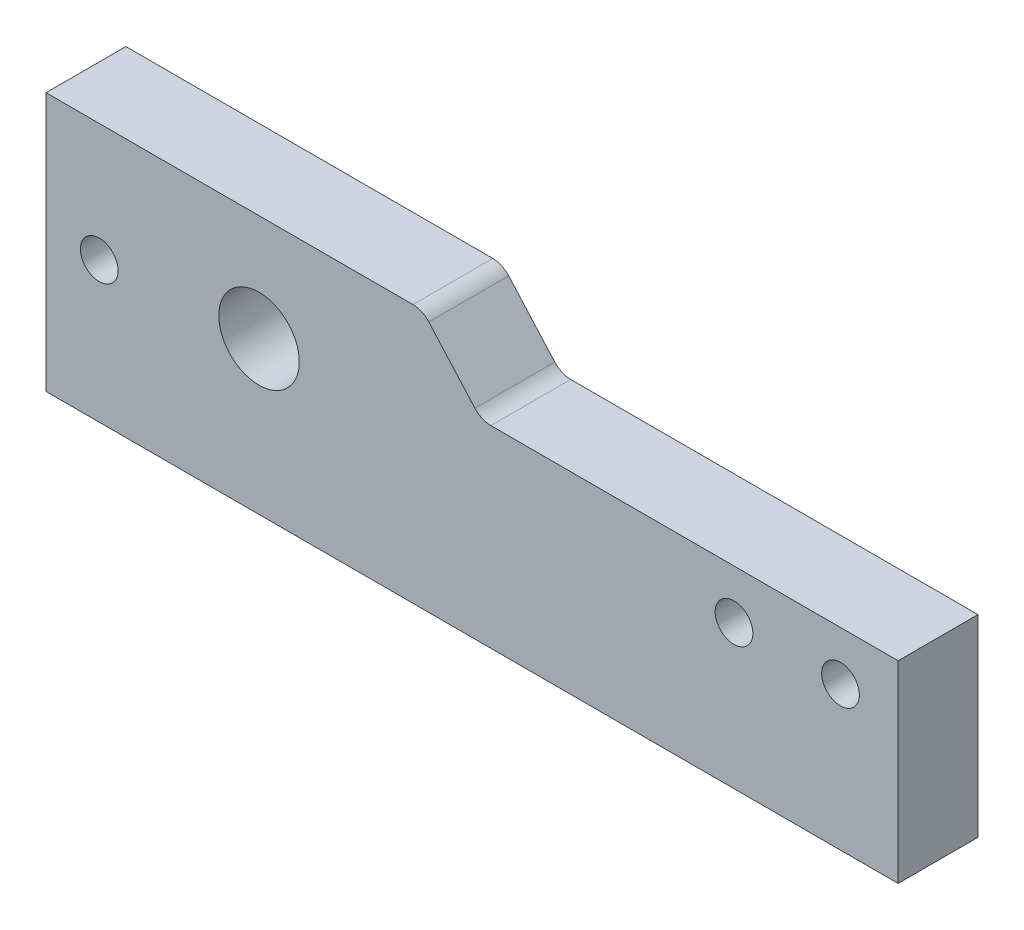
from build123d import *

# Parameters (mm, degrees)
BOSS_EXTRUDE1_DEPTH   = 9.525
SKETCH6_R             = 4.800000000000002
CUT_EXTRUDE1_DEPTH    = 57.261143340675204
SKETCH10_R            = 2.2859999999999947
CUT_EXTRUDE2_DEPTH    = 3.8099999999999996
F_8_CLEARANCE_HOLE1_D = 4.4958
SKETCH13_W            = 109.6136957213275
SKETCH13_H            = 27.196963560799638
CUT_EXTRUDE3_DEPTH    = 57.261143340675204
CUT_EXTRUDE5_DEPTH    = 57.2611433406752
FILLET1_R             = 2.54
SKETCH15_R            = 2.24789999999999
CUT_EXTRUDE6_DEPTH    = 57.26114334073907


with BuildPart() as part:
    # Sketch1 → Boss-Extrude1 (new body)
    with BuildSketch(Plane.XY):
        Polygon((50.79999999999998, -22.225), (-50.800000000000004, -22.225000000000012), (-50.800000000000004, 22.224999999999984), (50.79999999999999, 22.224999999999998), align=None)
    extrude(amount=BOSS_EXTRUDE1_DEPTH)

    # Sketch6 → Cut-Extrude1 (cut, through all)
    with BuildSketch(Plane.XY):
        with Locations(Location((-25.4, 9.524999999999999, 0), (0, 0, 180))):
            Circle(SKETCH6_R)
    extrude(amount=CUT_EXTRUDE1_DEPTH, mode=Mode.SUBTRACT)

    # Sketch10 → Cut-Extrude2 (cut)
    with BuildSketch(Plane.XY.offset(9.525)):
        with Locations((-46.11545283004946, -16.76399999999999)):
            Circle(SKETCH10_R)
    extrude(amount=-CUT_EXTRUDE2_DEPTH, mode=Mode.SUBTRACT)

    # #8 Clearance Hole1 (through all)
    with Locations(Plane(origin=(0, 0, 0), x_dir=(-1, 0, 0), z_dir=(0, 0, -1))):
        with Locations((-43.931814057, 8.51848178), (-31.231814057, 8.51848178)):
            Hole(F_8_CLEARANCE_HOLE1_D / 2)

    # Sketch13 → Cut-Extrude3 (cut, through all)
    with BuildSketch(Plane(origin=(0, 0, 0), x_dir=(-1, 0, 0), z_dir=(0, 0, -1))):
        with Locations((0, -22.225000000072345)):
            Rectangle(SKETCH13_W, SKETCH13_H)
    extrude(amount=-CUT_EXTRUDE3_DEPTH, mode=Mode.SUBTRACT)

    # Sketch14 → Cut-Extrude5 (cut, through all)
    with BuildSketch(Plane(origin=(0, 0, 0), x_dir=(-1, 0, 0), z_dir=(0, 0, -1))):
        Polygon((-50.80000000007075, 14.368885078592964), (-1.0960952551413707, 14.368885078592964), (-0.33859307620571544, 15.218043280381785), (6.4513217163673575, 22.82952215911174), (6.4513217163673575, 26.369267610296045), (-61.117569834071936, 26.369267610296045), (-61.117569834071936, 13.29236417327235), align=None)
    extrude(amount=-CUT_EXTRUDE5_DEPTH, mode=Mode.SUBTRACT)

    # Fillet1
    fillet1_edges = [part.edges().sort_by_distance(p)[0] for p in [
        (-5.912050174530525, 22.22499999999999, 4.7625),
        (1.0960952551413707, 14.368885078592964, 4.7625),
    ]]
    fillet(fillet1_edges, radius=FILLET1_R)

    # Sketch15 → Cut-Extrude6 (cut, through all)
    with BuildSketch(Plane(origin=(0, 0, 0), x_dir=(-1, 0, 0), z_dir=(0, 0, -1))):
        with Locations((44.4499999999996, 8.139974193482002)):
            Circle(SKETCH15_R)
    extrude(amount=-CUT_EXTRUDE6_DEPTH, mode=Mode.SUBTRACT)


solid = part.part
